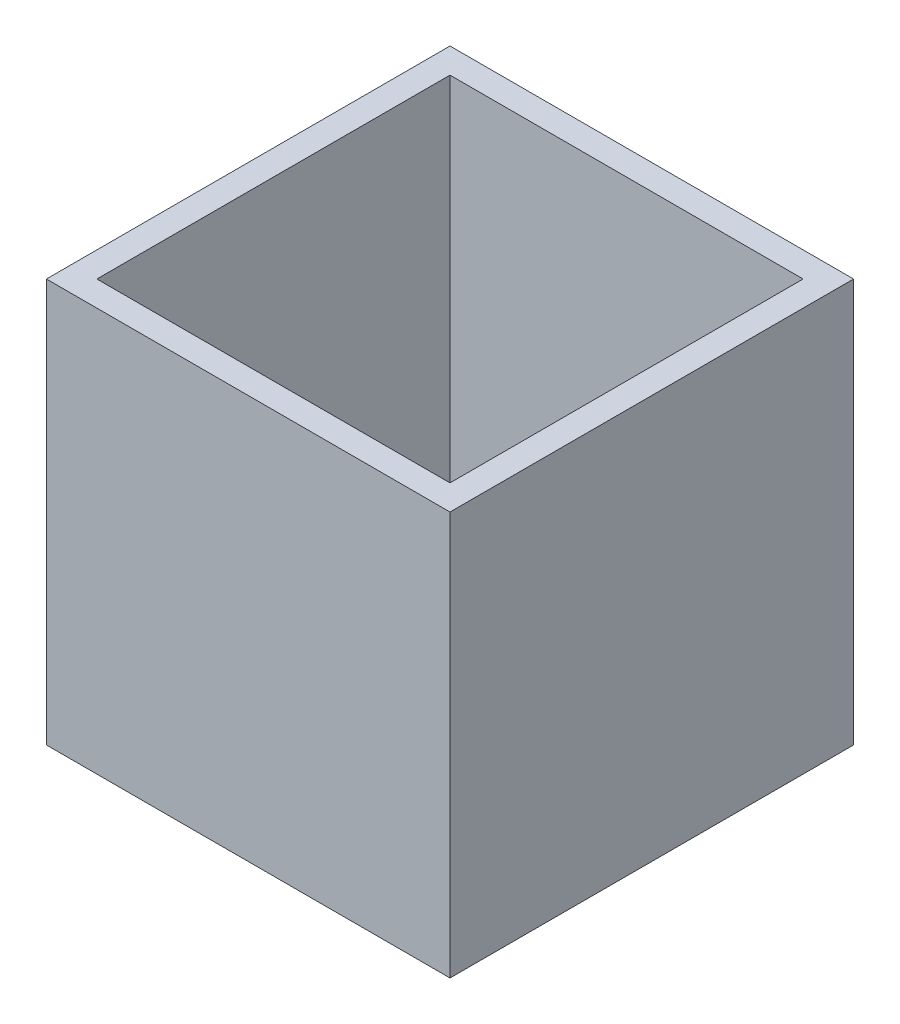
from build123d import *

# Parameters (mm, degrees)
SKETCH1_W           = 25.4
SKETCH1_H           = 25.4
SKETCH1_W_2         = 22.225
SKETCH1_H_2         = 22.225
BOSS_EXTRUDE1_DEPTH = 25.4


with BuildPart() as part:
    # Sketch1 → Boss-Extrude1 (new body)
    with BuildSketch(Plane(origin=(0, 0, 0), x_dir=(1, 0, 0), z_dir=(0, 1, 0))):
        Rectangle(SKETCH1_W, SKETCH1_H)
        Rectangle(SKETCH1_W_2, SKETCH1_H_2, mode=Mode.SUBTRACT)
    extrude(amount=BOSS_EXTRUDE1_DEPTH)


solid = part.part
